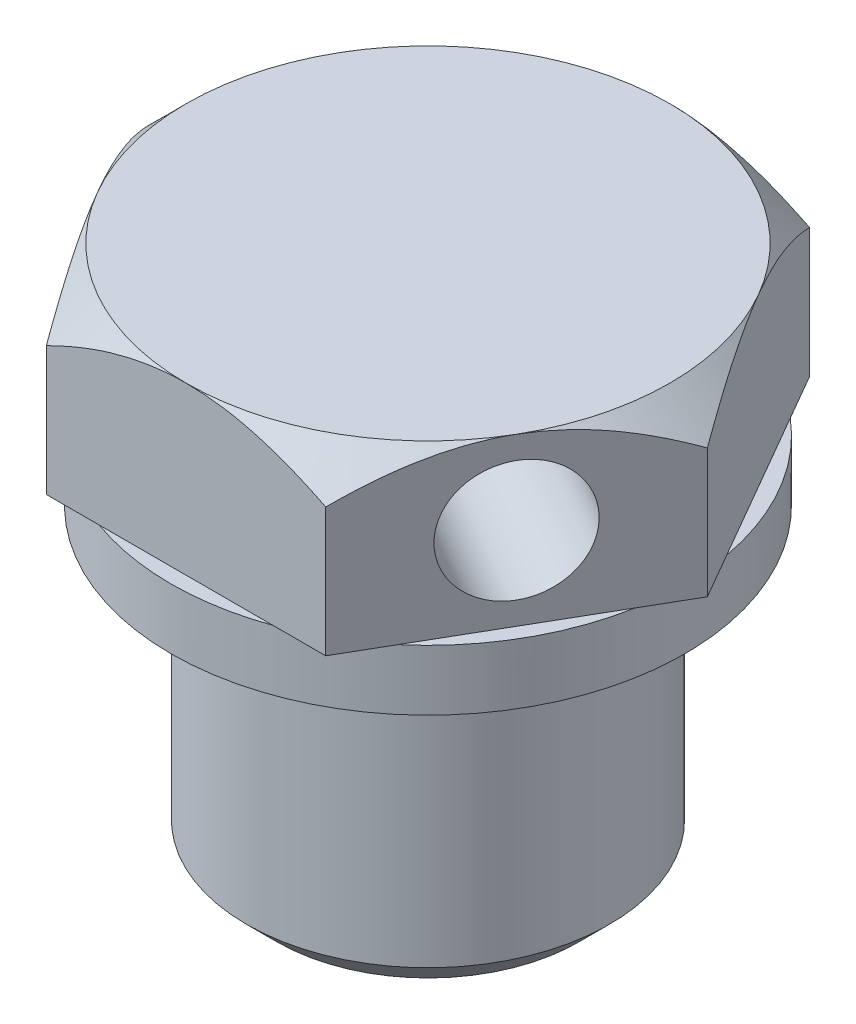
from build123d import *

# Parameters (mm, degrees)
BOSS_EXTRUDE1_DEPTH       = 5.5
SKETCH3_OUTSIDE_W         = 37.596
SKETCH3_OUTSIDE_H         = 36.12
SKETCH3_OUTSIDE_R         = 8
CUT_EXTRUDE1_DEPTH        = 5.5
CUT_EXTRUDE1_DRAFT        = -45
F_4_0MM_DOWEL_HOLE1_D     = 4
F_4_0MM_DOWEL_HOLE1_DEPTH = 16
F_4_0MM_DOWEL_HOLE1_TIP   = 1.201721238
CUT_EXTRUDE2_REACH        = 28.904
SKETCH6_R                 = 2


with BuildPart() as part:
    # Sketch1 → Revolve1 (revolve)
    with BuildSketch(Plane.XY, mode=Mode.PRIVATE) as revolve1_sk:
        with BuildLine():
            Line((0, 0), (-5, 0))
            Line((-5, 0), (-6, 1))
            Line((-6, 1), (-6, 8.5))
            ThreePointArc((-6, 8.5), (-5.25, 9.25), (-6, 10))
            Line((-6, 10), (-8.5, 10))
            Line((-8.5, 10), (-8.5, 12))
            Line((-8.5, 12), (0, 12))
            Line((0, 12), (0, 0))
        make_face()
    revolve(revolve1_sk.sketch.rotate(Axis((0, 12, 0), (0, -1, 0)), 270), axis=Axis((0, 12, 0), (0, -1, 0)))

    # Sketch2 → Boss-Extrude1 (add)
    with BuildSketch(Plane(origin=(0, 12, 0), x_dir=(1, 0, 0), z_dir=(0, 1, 0))):
        Polygon((-4.618802154, 8), (-9.237604307, 0), (-4.618802154, -8), (4.618802154, -8), (9.237604307, 0), (4.618802154, 8), align=None)
    extrude(amount=BOSS_EXTRUDE1_DEPTH)


with BuildPart() as cut_extrude1_tool:
    # Sketch3 outside → Cut-Extrude1 (with draft: the straight prism first)
    with BuildSketch(Plane(origin=(0, 17.5, 0), x_dir=(1, 0, 0), z_dir=(0, 1, 0))):
        Rectangle(SKETCH3_OUTSIDE_W, SKETCH3_OUTSIDE_H)
        Circle(SKETCH3_OUTSIDE_R, mode=Mode.SUBTRACT)
    extrude(amount=-CUT_EXTRUDE1_DEPTH)
    # Cut-Extrude1: the draft: its side faces are tilted about the plane it starts from
    cut_extrude1_sides = [cut_extrude1_tool.faces().sort_by_distance(p)[0] for p in [
        (0, 14.75, 18.06),
        (18.798, 14.75, 0),
        (0, 14.75, -18.06),
        (-18.798, 14.75, 0),
        (-8, 14.75, 0),
    ]]
    draft(cut_extrude1_sides, Plane(origin=(0, 17.5, 0), x_dir=(1, 0, 0), z_dir=(0, 1, 0)), CUT_EXTRUDE1_DRAFT)


with BuildPart() as part_1:
    add(part.part)

    # Cut-Extrude1: cut by cut_extrude1_tool
    add(cut_extrude1_tool.part, mode=Mode.SUBTRACT)

    # Ø4.0mm Dowel Hole1
    with Locations(Plane(origin=(0, 0, 0), x_dir=(-1, 0, 0), z_dir=(0, -1, 0))):
        with Locations((0, 0)):
            Hole(F_4_0MM_DOWEL_HOLE1_D / 2, depth=F_4_0MM_DOWEL_HOLE1_DEPTH)
            with Locations((0, 0, -(F_4_0MM_DOWEL_HOLE1_DEPTH + F_4_0MM_DOWEL_HOLE1_TIP / 2))):  # 118° drill point
                Cone(0, F_4_0MM_DOWEL_HOLE1_D / 2, F_4_0MM_DOWEL_HOLE1_TIP, mode=Mode.SUBTRACT)

    # Sketch6 → Cut-Extrude2 (cut, up to next)
    with BuildSketch(Plane(origin=(6.92820323, 0, 4), x_dir=(0.5, 0, -0.8660254037844386), z_dir=(0.8660254037844387, 0, 0.5000000000000001)), mode=Mode.PRIVATE) as cut_extrude2_sk1:
        with Locations((0, 14.75)):
            Circle(SKETCH6_R)
    cut_extrude2_tool1 = extrude(cut_extrude2_sk1.sketch, amount=-CUT_EXTRUDE2_REACH, mode=Mode.PRIVATE) & part_1.part
    add(cut_extrude2_tool1.solids().sort_by_distance((6.928203, 14.75, 4))[0], mode=Mode.SUBTRACT)


solid = part_1.part
